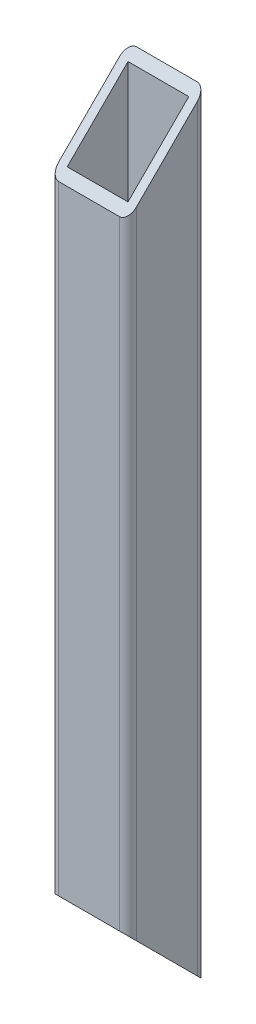
from build123d import *

# Parameters (mm, degrees)
BOSS_EXTRUDE1_DEPTH     = 254.788
SKETCH3_W               = 20
SKETCH3_H               = 20
CUT_EXTRUDE1_DEPTH      = 1040.5
CUT_EXTRUDE4_DEPTH      = 258.211828935
CUT_EXTRUDE4_DEPTH_BACK = 258.211828935
CUT_EXTRUDE8_DEPTH      = 258.211828935
CUT_EXTRUDE8_DEPTH_BACK = 258.211828935


with BuildPart() as part:
    # Sketch1 → Boss-Extrude1 (new body)
    with BuildSketch(Plane(origin=(0, 0, 0), x_dir=(1, 0, 0), z_dir=(0, 1, 0))):
        with BuildLine():
            Line((2.8, 0), (22.8, 0))
            ThreePointArc((22.8, 0), (24.779898987, -0.820101013), (25.6, -2.8))
            Line((25.6, -2.8), (25.6, -22.8))
            ThreePointArc((25.6, -22.8), (24.779898987, -24.779898987), (22.8, -25.6))
            Line((22.8, -25.6), (2.8, -25.6))
            ThreePointArc((2.8, -25.6), (0.820101013, -24.779898987), (0, -22.8))
            Line((0, -22.8), (0, -2.8))
            ThreePointArc((0, -2.8), (0.820101013, -0.820101013), (2.8, 0))
        make_face()
    extrude(amount=BOSS_EXTRUDE1_DEPTH)

    # Sketch3 → Cut-Extrude1 (cut)
    with BuildSketch(Plane(origin=(0, 0, 0), x_dir=(-1, 0, 0), z_dir=(0, -1, 0))):
        with Locations((-12.8, -12.8)):
            Rectangle(SKETCH3_W, SKETCH3_H)
    extrude(amount=-CUT_EXTRUDE1_DEPTH, mode=Mode.SUBTRACT)

    # Sketch4 → Cut-Extrude4 (cut, two sides: drawn at the far end of the back side and taken through both)
    with BuildSketch(Plane.ZY.offset(-1.4).offset(-CUT_EXTRUDE4_DEPTH_BACK)):
        Polygon((-369.209949856, -369.209949856), (0, 0), (26.086303166, 26.086303166), (395.296253022, 395.296253022), (1133.716152734, -343.123646689), (369.209949856, -1107.629849567), align=None)
    extrude(amount=CUT_EXTRUDE4_DEPTH + CUT_EXTRUDE4_DEPTH_BACK, mode=Mode.SUBTRACT)

    # Sketch5 → Cut-Extrude8 (cut, two sides: drawn at the far end of the back side and taken through both)
    with BuildSketch(Plane.ZY.offset(-1.4).offset(-CUT_EXTRUDE8_DEPTH_BACK)):
        Polygon((-369.209949856, 623.997949856), (0, 254.788), (25.6, 229.188), (394.809949856, -140.021949856), (1133.229849567, 598.397949856), (369.209949856, 1362.417849567), align=None)
    extrude(amount=CUT_EXTRUDE8_DEPTH + CUT_EXTRUDE8_DEPTH_BACK, mode=Mode.SUBTRACT)


solid = part.part
